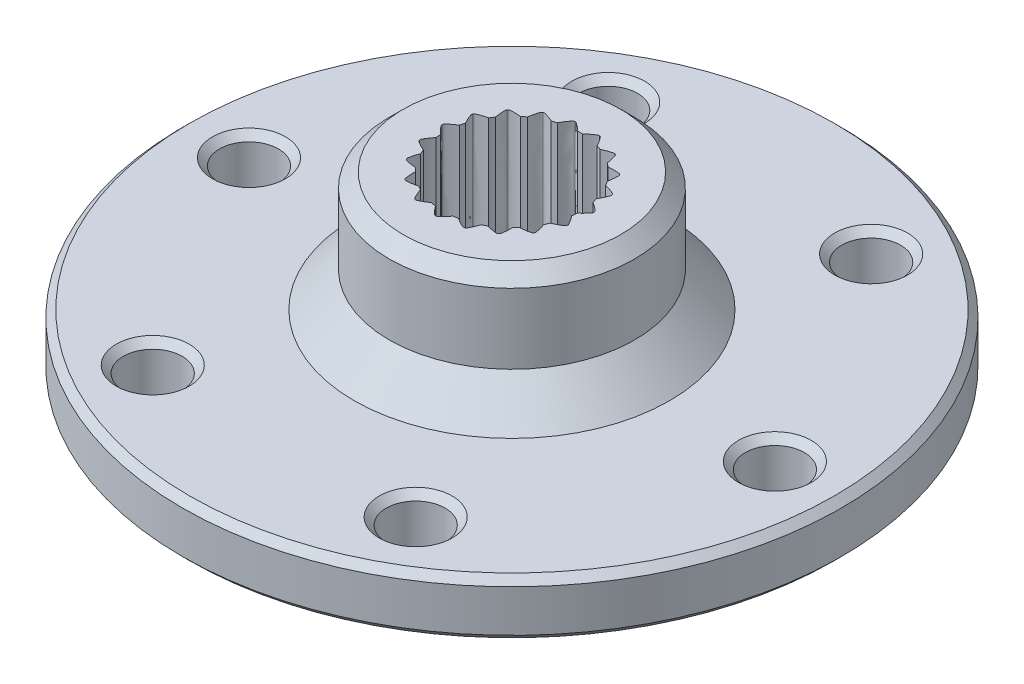
from build123d import *

# Parameters (mm, degrees)
SKETCH1_R            = 47
BOSS_EXTRUDE1_DEPTH  = 8
M8_CLEARANCE_HOLE1_D = 8.4
SKETCH12_R           = 17.5
BOSS_EXTRUDE5_DEPTH  = 17
SKETCH13_R           = 28
BOSS_EXTRUDE6_DEPTH  = 5.08
CHAMFER11_SIZE       = 5
CHAMFER12_SIZE       = 2
SKETCH14_R           = 22.5
CUT_EXTRUDE3_DEPTH   = 5.08
CHAMFER13_SIZE       = 5
CUT_EXTRUDE4_DEPTH   = 73.957565749
CHAMFER14_SIZE       = 1


with BuildPart() as part:
    # Sketch1 → Boss-Extrude1 (new body)
    with BuildSketch(Plane(origin=(0, 0, 0), x_dir=(1, 0, 0), z_dir=(0, 1, 0))):
        with Locations(Location((0, 0, 0), (0, 0, 270))):
            Circle(SKETCH1_R)
    extrude(amount=BOSS_EXTRUDE1_DEPTH)

    # M8 Clearance Hole1 (through all)
    with Locations(Plane(origin=(0, 8, 0), x_dir=(1, 0, 0), z_dir=(0, 1, 0))):
        with Locations((-18.75, 32.475952642), (-37.5, 0), (-18.75, -32.475952642), (18.75, -32.475952642), (37.5, 0), (18.75, 32.475952642)):
            Hole(M8_CLEARANCE_HOLE1_D / 2)

    # Sketch12 → Boss-Extrude5 (add)
    with BuildSketch(Plane(origin=(0, 8, 0), x_dir=(1, 0, 0), z_dir=(0, 1, 0))):
        with Locations(Location((0, 0, 0), (0, 0, 270))):
            Circle(SKETCH12_R)
    extrude(amount=BOSS_EXTRUDE5_DEPTH)

    # Sketch13 → Boss-Extrude6 (add)
    with BuildSketch(Plane.XZ):
        with Locations(Location((0, 0, 0), (0, 0, 90))):
            Circle(SKETCH13_R)
    extrude(amount=BOSS_EXTRUDE6_DEPTH)

    # Chamfer11
    chamfer11_edges = [part.edges().sort_by_distance(p)[0] for p in [
        (0, 8, -17.5),
    ]]
    chamfer(chamfer11_edges, length=CHAMFER11_SIZE)

    # Chamfer12
    chamfer12_edges = [part.edges().sort_by_distance(p)[0] for p in [
        (0, 25, -17.5),
    ]]
    chamfer(chamfer12_edges, length=CHAMFER12_SIZE)

    # Sketch14 → Cut-Extrude3 (cut)
    with BuildSketch(Plane.XZ.offset(5.08)):
        with Locations(Location((0, 0, 0), (0, 0, 270))):
            Circle(SKETCH14_R)
    extrude(amount=-CUT_EXTRUDE3_DEPTH, mode=Mode.SUBTRACT)

    # Chamfer13
    chamfer13_edges = [part.edges().sort_by_distance(p)[0] for p in [
        (0, 0, 22.5),
    ]]
    chamfer(chamfer13_edges, length=CHAMFER13_SIZE)

    # Sketch19 → Cut-Extrude4 (cut, through all)
    with BuildSketch(Plane(origin=(0, 25, 0), x_dir=(1, 0, 0), z_dir=(0, 1, 0))):
        with BuildLine():
            Line((3.525574498, -10.269647669), (3.55492472, -10.259524796))
            add(Edge.make_bspline(
                [(3.55492472, -10.259524796), (3.63112206, -10.233122422), (3.690206879, -10.185276762), (3.751505162, -10.086364139), (3.76893335, -10.050390822), (3.8052542, -9.981218164), (3.894201893, -9.808744646), (4.037820288, -9.502743022), (4.196057711, -9.106848295), (4.280782825, -8.852599963), (4.318331485, -8.728264707)],
                knots=[0, 0, 0, 0, 0.125, 0.125, 0.1875, 0.1875, 0.25, 0.5, 0.75, 1, 1, 1, 1], degree=3))
            ThreePointArc((4.318331485, -8.728264707), (4.634823308, -8.564403337), (4.945107174, -8.389070666))
            add(Edge.make_bspline(
                [(4.945107174, -8.389070666), (5.069733653, -8.425641126), (5.328922638, -8.493772712), (5.74689939, -8.577835597), (6.081625656, -8.624970097), (6.274664484, -8.644840148), (6.352439136, -8.652267408), (6.392087106, -8.657352653), (6.508420421, -8.660135862), (6.580791537, -8.636841128), (6.644570714, -8.587491998)],
                knots=[0, 0, 0, 0, 0.25, 0.5, 0.75, 0.8125, 0.8125, 0.875, 0.875, 1, 1, 1, 1], degree=3))
            Line((6.644570714, -8.587491998), (6.669098294, -8.568457664))
            Line((6.669098294, -8.568457664), (6.693571348, -8.549353274))
            add(Edge.make_bspline(
                [(6.693571348, -8.549353274), (6.75706727, -8.499640217), (6.79741525, -8.435202158), (6.823275347, -8.321745374), (6.828078711, -8.282062267), (6.839971271, -8.204844214), (6.868097473, -8.012834517), (6.904575662, -7.676780089), (6.925692538, -7.250956423), (6.923272713, -6.982973768), (6.918415291, -6.853183309)],
                knots=[0, 0, 0, 0, 0.125, 0.125, 0.1875, 0.1875, 0.25, 0.5, 0.75, 1, 1, 1, 1], degree=3))
            ThreePointArc((6.918415291, -6.853183309), (7.164553015, -6.595435673), (7.40109442, -6.328854004))
            add(Edge.make_bspline(
                [(7.40109442, -6.328854004), (7.530842701, -6.322976823), (7.798110402, -6.303258326), (8.220735194, -6.247049623), (8.552629616, -6.182944804), (8.741660862, -6.139058637), (8.817633096, -6.120830079), (8.856784006, -6.112766116), (8.967717768, -6.077625158), (9.028603829, -6.032093734), (9.072903639, -5.964709411)],
                knots=[0, 0, 0, 0, 0.25, 0.5, 0.75, 0.8125, 0.8125, 0.875, 0.875, 1, 1, 1, 1], degree=3))
            Line((9.072903639, -5.964709411), (9.089921809, -5.938742317))
            Line((9.089921809, -5.938742317), (9.10686566, -5.912726668))
            add(Edge.make_bspline(
                [(9.10686566, -5.912726668), (9.150779394, -5.84509011), (9.168018206, -5.771042515), (9.155637774, -5.655336372), (9.147295794, -5.616243756), (9.133471322, -5.539348082), (9.097728123, -5.348609437), (9.023113128, -5.018918916), (8.904821115, -4.609310913), (8.815518577, -4.356634013), (8.768781451, -4.235453161)],
                knots=[0, 0, 0, 0, 0.125, 0.125, 0.1875, 0.1875, 0.25, 0.5, 0.75, 1, 1, 1, 1], degree=3))
            ThreePointArc((8.768781451, -4.235453161), (8.917892232, -3.911750215), (9.055058245, -3.582807807))
            add(Edge.make_bspline(
                [(9.055058245, -3.582807807), (9.17586809, -3.53511987), (9.422251903, -3.429688096), (9.803726783, -3.239298889), (10.096823448, -3.070901504), (10.261362645, -2.968014865), (10.327299691, -2.926105836), (10.361710932, -2.905766521), (10.455223747, -2.836509463), (10.498026804, -2.773675386), (10.518046673, -2.695558007)],
                knots=[0, 0, 0, 0, 0.25, 0.5, 0.75, 0.8125, 0.8125, 0.875, 0.875, 1, 1, 1, 1], degree=3))
            Line((10.518046673, -2.695558007), (10.52571125, -2.665472091))
            Line((10.52571125, -2.665472091), (10.533289769, -2.635364382))
            add(Edge.make_bspline(
                [(10.533289769, -2.635364382), (10.552862582, -2.557133793), (10.545124133, -2.481500868), (10.495844783, -2.376083923), (10.475261444, -2.341818089), (10.437218035, -2.273577633), (10.341478764, -2.104779533), (10.163856278, -1.817180003), (9.918974151, -1.468175044), (9.752466216, -1.258185363), (9.668914078, -1.158745944)],
                knots=[0, 0, 0, 0, 0.125, 0.125, 0.1875, 0.1875, 0.25, 0.5, 0.75, 1, 1, 1, 1], degree=3))
            ThreePointArc((9.668914078, -1.158745944), (9.704839451, -0.804165924), (9.727766006, -0.448508792))
            add(Edge.make_bspline(
                [(9.727766006, -0.448508792), (9.826545792, -0.364177827), (10.02534621, -0.184457943), (10.324332454, 0.119480142), (10.546869792, 0.373921625), (10.669086564, 0.524659372), (10.71784312, 0.585707377), (10.743785701, 0.616117964), (10.809744003, 0.711986044), (10.82982568, 0.785313728), (10.823396147, 0.865698933)],
                knots=[0, 0, 0, 0, 0.25, 0.5, 0.75, 0.8125, 0.8125, 0.875, 0.875, 1, 1, 1, 1], degree=3))
            Line((10.823396147, 0.865698933), (10.820876555, 0.896643395))
            Line((10.820876555, 0.896643395), (10.818268492, 0.927580526))
            add(Edge.make_bspline(
                [(10.818268492, 0.927580526), (10.811379365, 1.007927648), (10.779502235, 1.076949902), (10.698664151, 1.160654088), (10.668069975, 1.186379905), (10.609930224, 1.23857023), (10.464569717, 1.367135894), (10.203187893, 1.581478561), (9.85825243, 1.832060371), (9.632582816, 1.976607194), (9.521269836, 2.043529377)],
                knots=[0, 0, 0, 0, 0.125, 0.125, 0.1875, 0.1875, 0.25, 0.5, 0.75, 1, 1, 1, 1], degree=3))
            ThreePointArc((9.521269836, 2.043529377), (9.44011673, 2.390562222), (9.346319379, 2.734393111))
            add(Edge.make_bspline(
                [(9.346319379, 2.734393111), (9.412364784, 2.846228535), (9.542038696, 3.08076109), (9.726136505, 3.465311646), (9.853999142, 3.778224543), (9.920649406, 3.960478624), (9.946941942, 4.034050108), (9.961604581, 4.071236507), (9.992860765, 4.183326817), (9.988044902, 4.259201914), (9.955862705, 4.333143961)],
                knots=[0, 0, 0, 0, 0.25, 0.5, 0.75, 0.8125, 0.8125, 0.875, 0.875, 1, 1, 1, 1], degree=3))
            Line((9.955862705, 4.333143961), (9.943431981, 4.361593656))
            Line((9.943431981, 4.361593656), (9.93091996, 4.390007692))
            add(Edge.make_bspline(
                [(9.93091996, 4.390007692), (9.898315437, 4.463764489), (9.845754009, 4.51869644), (9.742117251, 4.571617219), (9.704827593, 4.586015228), (9.632891843, 4.616499791), (9.453662166, 4.690900932), (9.13684578, 4.808759383), (8.729236091, 4.933763618), (8.468859602, 4.997203692), (8.34184827, 5.02435658)],
                knots=[0, 0, 0, 0, 0.125, 0.125, 0.1875, 0.1875, 0.25, 0.5, 0.75, 1, 1, 1, 1], degree=3))
            ThreePointArc((8.34184827, 5.02435658), (8.152410882, 5.326235859), (7.952054023, 5.620981091))
            add(Edge.make_bspline(
                [(7.952054023, 5.620981091), (7.978208003, 5.748201872), (8.024703229, 6.012131856), (8.07396275, 6.435622864), (8.093294785, 6.773098207), (8.09715595, 6.967118564), (8.098135262, 7.045240915), (8.099929035, 7.085173403), (8.093096009, 7.201339217), (8.063904479, 7.271539484), (8.009457059, 7.331025605)],
                knots=[0, 0, 0, 0, 0.25, 0.5, 0.75, 0.8125, 0.8125, 0.875, 0.875, 1, 1, 1, 1], degree=3))
            Line((8.009457059, 7.331025605), (7.988462265, 7.353897568))
            Line((7.988462265, 7.353897568), (7.967402157, 7.376709406))
            add(Edge.make_bspline(
                [(7.967402157, 7.376709406), (7.912615444, 7.435883185), (7.845065564, 7.470772104), (7.729860782, 7.487174688), (7.689916555, 7.488684641), (7.611980161, 7.494159967), (7.418303631, 7.506334068), (7.080384654, 7.514936511), (6.654271574, 7.500817022), (6.387404043, 7.47627563), (6.258458007, 7.460716788)],
                knots=[0, 0, 0, 0, 0.125, 0.125, 0.1875, 0.1875, 0.25, 0.5, 0.75, 1, 1, 1, 1], degree=3))
            ThreePointArc((6.258458007, 7.460716788), (5.981264817, 7.684729195), (5.696060225, 7.898448551))
            add(Edge.make_bspline(
                [(5.696060225, 7.898448551), (5.67948859, 8.027268343), (5.637766651, 8.291994848), (5.54684985, 8.708534485), (5.455556357, 9.034001584), (5.396210007, 9.218763102), (5.371769971, 9.29297055), (5.360500494, 9.331321824), (5.316318723, 9.438974773), (5.26591488, 9.495892922), (5.19510246, 9.534476872)],
                knots=[0, 0, 0, 0, 0.25, 0.5, 0.75, 0.8125, 0.8125, 0.875, 0.875, 1, 1, 1, 1], degree=3))
            Line((5.19510246, 9.534476872), (5.167818708, 9.549292571))
            Line((5.167818708, 9.549292571), (5.140492703, 9.564030195))
            add(Edge.make_bspline(
                [(5.140492703, 9.564030195), (5.069460791, 9.602208559), (4.994242536, 9.613273689), (4.879953957, 9.591380605), (4.841683737, 9.579838875), (4.766192316, 9.559711626), (4.579056791, 9.508339435), (4.256653987, 9.406753661), (3.85821348, 9.255040514), (3.613774145, 9.145177097), (3.496866709, 9.088592566)],
                knots=[0, 0, 0, 0, 0.125, 0.125, 0.1875, 0.1875, 0.25, 0.5, 0.75, 1, 1, 1, 1], degree=3))
            ThreePointArc((3.496866709, 9.088592566), (3.161955901, 9.210462881), (2.822809919, 9.319996554))
            add(Edge.make_bspline(
                [(2.822809919, 9.319996554), (2.765308463, 9.436455733), (2.639890577, 9.673291534), (2.4186497, 10.037741268), (2.226623746, 10.315930713), (2.110500978, 10.471411614), (2.063290052, 10.533662631), (2.040178549, 10.566276734), (1.963435811, 10.653750952), (1.897281696, 10.691219017), (1.8177779, 10.704719627)],
                knots=[0, 0, 0, 0, 0.25, 0.5, 0.75, 0.8125, 0.8125, 0.875, 0.875, 1, 1, 1, 1], degree=3))
            Line((1.8177779, 10.704719627), (1.787161807, 10.709873551))
            Line((1.787161807, 10.709873551), (1.756531102, 10.71493991))
            add(Edge.make_bspline(
                [(1.756531102, 10.71493991), (1.6769514, 10.727985641), (1.602215836, 10.714027905), (1.5012284, 10.656211607), (1.468779359, 10.63286892), (1.403913579, 10.589320197), (1.243598096, 10.479968687), (0.971648813, 10.279203091), (0.644058089, 10.00633676), (0.448535745, 9.823056723), (0.356335643, 9.731578316)],
                knots=[0, 0, 0, 0, 0.125, 0.125, 0.1875, 0.1875, 0.25, 0.5, 0.75, 1, 1, 1, 1], degree=3))
            ThreePointArc((0.356335643, 9.731578316), (0, 9.7381), (-0.356335643, 9.731578316))
            add(Edge.make_bspline(
                [(-0.356335643, 9.731578316), (-0.448535745, 9.823056723), (-0.644058603, 10.006336986), (-0.971648673, 10.279203033), (-1.243598097, 10.479968681), (-1.403913579, 10.589320197), (-1.468779359, 10.63286892), (-1.5012284, 10.656211607), (-1.602215836, 10.714027905), (-1.6769514, 10.727985641), (-1.756531102, 10.71493991)],
                knots=[0, 0, 0, 0, 0.25, 0.5, 0.75, 0.8125, 0.8125, 0.875, 0.875, 1, 1, 1, 1], degree=3))
            Line((-1.756531102, 10.71493991), (-1.787161807, 10.709873551))
            Line((-1.787161807, 10.709873551), (-1.8177779, 10.704719627))
            add(Edge.make_bspline(
                [(-1.8177779, 10.704719627), (-1.897281696, 10.691219017), (-1.963435811, 10.653750952), (-2.040178549, 10.566276734), (-2.063290052, 10.533662631), (-2.110500978, 10.471411614), (-2.226623749, 10.315930719), (-2.418649588, 10.037741369), (-2.639890989, 9.673291153), (-2.765308463, 9.436455733), (-2.822809919, 9.319996554)],
                knots=[0, 0, 0, 0, 0.125, 0.125, 0.1875, 0.1875, 0.25, 0.5, 0.75, 1, 1, 1, 1], degree=3))
            ThreePointArc((-2.822809919, 9.319996554), (-3.161955901, 9.210462881), (-3.496866709, 9.088592566))
            add(Edge.make_bspline(
                [(-3.496866709, 9.088592566), (-3.613774145, 9.145177097), (-3.858214039, 9.255040561), (-4.256653837, 9.406753651), (-4.57905679, 9.508339429), (-4.766192316, 9.559711626), (-4.841683737, 9.579838875), (-4.879953957, 9.591380605), (-4.994242536, 9.613273689), (-5.069460791, 9.602208559), (-5.140492703, 9.564030195)],
                knots=[0, 0, 0, 0, 0.25, 0.5, 0.75, 0.8125, 0.8125, 0.875, 0.875, 1, 1, 1, 1], degree=3))
            Line((-5.140492703, 9.564030195), (-5.167818708, 9.549292571))
            Line((-5.167818708, 9.549292571), (-5.19510246, 9.534476872))
            add(Edge.make_bspline(
                [(-5.19510246, 9.534476872), (-5.26591488, 9.495892922), (-5.316318723, 9.438974773), (-5.360500494, 9.331321824), (-5.371769971, 9.29297055), (-5.396210007, 9.218763102), (-5.455556361, 9.034001588), (-5.546849776, 8.708534617), (-5.637766917, 8.291994354), (-5.67948859, 8.027268343), (-5.696060225, 7.898448551)],
                knots=[0, 0, 0, 0, 0.125, 0.125, 0.1875, 0.1875, 0.25, 0.5, 0.75, 1, 1, 1, 1], degree=3))
            ThreePointArc((-5.696060225, 7.898448551), (-5.981264817, 7.684729195), (-6.258458007, 7.460716788))
            add(Edge.make_bspline(
                [(-6.258458007, 7.460716788), (-6.387404043, 7.47627563), (-6.654272118, 7.500816885), (-7.080384508, 7.51493655), (-7.418303628, 7.506334063), (-7.611980161, 7.494159967), (-7.689916555, 7.488684641), (-7.729860782, 7.487174688), (-7.845065564, 7.470772104), (-7.912615444, 7.435883185), (-7.967402157, 7.376709406)],
                knots=[0, 0, 0, 0, 0.25, 0.5, 0.75, 0.8125, 0.8125, 0.875, 0.875, 1, 1, 1, 1], degree=3))
            Line((-7.967402157, 7.376709406), (-7.988462265, 7.353897568))
            Line((-7.988462265, 7.353897568), (-8.009457059, 7.331025605))
            add(Edge.make_bspline(
                [(-8.009457059, 7.331025605), (-8.063904479, 7.271539484), (-8.093096009, 7.201339217), (-8.099929035, 7.085173403), (-8.098135262, 7.045240915), (-8.09715595, 6.967118564), (-8.09329479, 6.773098209), (-8.073962723, 6.435623012), (-8.02470332, 6.012131303), (-7.978208003, 5.748201872), (-7.952054023, 5.620981091)],
                knots=[0, 0, 0, 0, 0.125, 0.125, 0.1875, 0.1875, 0.25, 0.5, 0.75, 1, 1, 1, 1], degree=3))
            ThreePointArc((-7.952054023, 5.620981091), (-8.152410882, 5.326235859), (-8.34184827, 5.02435658))
            add(Edge.make_bspline(
                [(-8.34184827, 5.02435658), (-8.468859602, 4.997203692), (-8.729236561, 4.933763312), (-9.136845654, 4.808759468), (-9.453662162, 4.690900928), (-9.632891843, 4.616499791), (-9.704827593, 4.586015228), (-9.742117251, 4.571617219), (-9.845754009, 4.51869644), (-9.898315437, 4.463764489), (-9.93091996, 4.390007692)],
                knots=[0, 0, 0, 0, 0.25, 0.5, 0.75, 0.8125, 0.8125, 0.875, 0.875, 1, 1, 1, 1], degree=3))
            Line((-9.93091996, 4.390007692), (-9.943431981, 4.361593656))
            Line((-9.943431981, 4.361593656), (-9.955862705, 4.333143961))
            add(Edge.make_bspline(
                [(-9.955862705, 4.333143961), (-9.988044902, 4.259201914), (-9.992860765, 4.183326817), (-9.961604581, 4.071236507), (-9.946941942, 4.034050108), (-9.920649406, 3.960478624), (-9.853999148, 3.778224543), (-9.726136528, 3.465311796), (-9.542038602, 3.080760537), (-9.412364784, 2.846228535), (-9.346319379, 2.734393111)],
                knots=[0, 0, 0, 0, 0.125, 0.125, 0.1875, 0.1875, 0.25, 0.5, 0.75, 1, 1, 1, 1], degree=3))
            ThreePointArc((-9.346319379, 2.734393111), (-9.44011673, 2.390562222), (-9.521269836, 2.043529377))
            add(Edge.make_bspline(
                [(-9.521269836, 2.043529377), (-9.632582816, 1.976607194), (-9.858252775, 1.832059929), (-10.203187801, 1.581478681), (-10.464569711, 1.367135891), (-10.609930224, 1.23857023), (-10.668069975, 1.186379905), (-10.698664151, 1.160654088), (-10.779502235, 1.076949902), (-10.811379365, 1.007927648), (-10.818268492, 0.927580526)],
                knots=[0, 0, 0, 0, 0.25, 0.5, 0.75, 0.8125, 0.8125, 0.875, 0.875, 1, 1, 1, 1], degree=3))
            Line((-10.818268492, 0.927580526), (-10.820876555, 0.896643395))
            Line((-10.820876555, 0.896643395), (-10.823396147, 0.865698933))
            add(Edge.make_bspline(
                [(-10.823396147, 0.865698933), (-10.82982568, 0.785313728), (-10.809744003, 0.711986044), (-10.743785701, 0.616117964), (-10.71784312, 0.585707377), (-10.669086564, 0.524659372), (-10.546869798, 0.373921623), (-10.324332524, 0.119480276), (-10.025345942, -0.184458436), (-9.826545792, -0.364177827), (-9.727766006, -0.448508792)],
                knots=[0, 0, 0, 0, 0.125, 0.125, 0.1875, 0.1875, 0.25, 0.5, 0.75, 1, 1, 1, 1], degree=3))
            ThreePointArc((-9.727766006, -0.448508792), (-9.704839451, -0.804165924), (-9.668914078, -1.158745944))
            add(Edge.make_bspline(
                [(-9.668914078, -1.158745944), (-9.752466216, -1.258185363), (-9.918974334, -1.468175575), (-10.163856231, -1.817179859), (-10.341478758, -2.104779533), (-10.437218035, -2.273577633), (-10.475261444, -2.341818089), (-10.495844783, -2.376083923), (-10.545124133, -2.481500868), (-10.552862582, -2.557133793), (-10.533289769, -2.635364382)],
                knots=[0, 0, 0, 0, 0.25, 0.5, 0.75, 0.8125, 0.8125, 0.875, 0.875, 1, 1, 1, 1], degree=3))
            Line((-10.533289769, -2.635364382), (-10.52571125, -2.665472091))
            Line((-10.52571125, -2.665472091), (-10.518046673, -2.695558007))
            add(Edge.make_bspline(
                [(-10.518046673, -2.695558007), (-10.498026804, -2.773675386), (-10.455223747, -2.836509463), (-10.361710932, -2.905766521), (-10.327299691, -2.926105836), (-10.261362645, -2.968014865), (-10.096823453, -3.070901507), (-9.803726893, -3.239298785), (-9.42225149, -3.429688475), (-9.17586809, -3.53511987), (-9.055058245, -3.582807807)],
                knots=[0, 0, 0, 0, 0.125, 0.125, 0.1875, 0.1875, 0.25, 0.5, 0.75, 1, 1, 1, 1], degree=3))
            ThreePointArc((-9.055058245, -3.582807807), (-8.917892232, -3.911750215), (-8.768781451, -4.235453161))
            add(Edge.make_bspline(
                [(-8.768781451, -4.235453161), (-8.815518577, -4.356634013), (-8.904821116, -4.609311474), (-9.02311313, -5.018918765), (-9.097728117, -5.348609436), (-9.133471322, -5.539348082), (-9.147295794, -5.616243756), (-9.155637774, -5.655336372), (-9.168018206, -5.771042515), (-9.150779394, -5.84509011), (-9.10686566, -5.912726668)],
                knots=[0, 0, 0, 0, 0.25, 0.5, 0.75, 0.8125, 0.8125, 0.875, 0.875, 1, 1, 1, 1], degree=3))
            Line((-9.10686566, -5.912726668), (-9.089921809, -5.938742317))
            Line((-9.089921809, -5.938742317), (-9.072903639, -5.964709411))
            add(Edge.make_bspline(
                [(-9.072903639, -5.964709411), (-9.028603829, -6.032093734), (-8.967717768, -6.077625158), (-8.856784006, -6.112766116), (-8.817633096, -6.120830079), (-8.741660862, -6.139058637), (-8.552629619, -6.182944809), (-8.220735332, -6.247049561), (-7.798109887, -6.303258551), (-7.530842701, -6.322976823), (-7.40109442, -6.328854004)],
                knots=[0, 0, 0, 0, 0.125, 0.125, 0.1875, 0.1875, 0.25, 0.5, 0.75, 1, 1, 1, 1], degree=3))
            ThreePointArc((-7.40109442, -6.328854004), (-7.164553015, -6.595435673), (-6.918415291, -6.853183309))
            add(Edge.make_bspline(
                [(-6.918415291, -6.853183309), (-6.923272713, -6.982973768), (-6.925692356, -7.250956954), (-6.904575713, -7.676779947), (-6.868097468, -8.012834514), (-6.839971271, -8.204844214), (-6.828078711, -8.282062267), (-6.823275347, -8.321745374), (-6.79741525, -8.435202158), (-6.75706727, -8.499640217), (-6.693571348, -8.549353274)],
                knots=[0, 0, 0, 0, 0.25, 0.5, 0.75, 0.8125, 0.8125, 0.875, 0.875, 1, 1, 1, 1], degree=3))
            Line((-6.693571348, -8.549353274), (-6.669098294, -8.568457664))
            Line((-6.669098294, -8.568457664), (-6.644570714, -8.587491998))
            add(Edge.make_bspline(
                [(-6.644570714, -8.587491998), (-6.580791537, -8.636841128), (-6.508420421, -8.660135862), (-6.392087106, -8.657352653), (-6.352439136, -8.652267408), (-6.274664484, -8.644840148), (-6.081625658, -8.624970102), (-5.74689954, -8.577835583), (-5.328922078, -8.493772758), (-5.069733653, -8.425641126), (-4.945107174, -8.389070666)],
                knots=[0, 0, 0, 0, 0.125, 0.125, 0.1875, 0.1875, 0.25, 0.5, 0.75, 1, 1, 1, 1], degree=3))
            ThreePointArc((-4.945107174, -8.389070666), (-4.634823308, -8.564403337), (-4.318331485, -8.728264707))
            add(Edge.make_bspline(
                [(-4.318331485, -8.728264707), (-4.280782825, -8.852599963), (-4.196057367, -9.106848738), (-4.037820382, -9.502742904), (-3.89420189, -9.808744641), (-3.8052542, -9.981218164), (-3.76893335, -10.050390822), (-3.751505162, -10.086364139), (-3.690206879, -10.185276762), (-3.63112206, -10.233122422), (-3.55492472, -10.259524796)],
                knots=[0, 0, 0, 0, 0.25, 0.5, 0.75, 0.8125, 0.8125, 0.875, 0.875, 1, 1, 1, 1], degree=3))
            Line((-3.55492472, -10.259524796), (-3.525574498, -10.269647669))
            Line((-3.525574498, -10.269647669), (-3.496195452, -10.279686579))
            add(Edge.make_bspline(
                [(-3.496195452, -10.279686579), (-3.41984837, -10.305652771), (-3.343834733, -10.30418647), (-3.234708384, -10.263780697), (-3.198859827, -10.24609731), (-3.127710847, -10.213819091), (-2.951583191, -10.132346055), (-2.65029801, -9.979080021), (-2.282262875, -9.763854892), (-2.059240299, -9.615256476), (-1.953240835, -9.540201353)],
                knots=[0, 0, 0, 0, 0.125, 0.125, 0.1875, 0.1875, 0.25, 0.5, 0.75, 1, 1, 1, 1], degree=3))
            ThreePointArc((-1.953240835, -9.540201353), (-1.60283858, -9.605285009), (-1.250289457, -9.657503191))
            add(Edge.make_bspline(
                [(-1.250289457, -9.657503191), (-1.174403694, -9.76290959), (-1.011714454, -9.975872154), (-0.73350456, -10.298936216), (-0.498309111, -10.541725087), (-0.358178791, -10.675972252), (-0.30136558, -10.729603584), (-0.273201183, -10.757968844), (-0.183107333, -10.831618588), (-0.111688433, -10.857687028), (-0.031046837, -10.857917613)],
                knots=[0, 0, 0, 0, 0.25, 0.5, 0.75, 0.8125, 0.8125, 0.875, 0.875, 1, 1, 1, 1], degree=3))
            Line((-0.031046837, -10.857917613), (0, -10.857962))
            Line((0, -10.857962), (0.031046837, -10.857917613))
            add(Edge.make_bspline(
                [(0.031046837, -10.857917613), (0.111688433, -10.857687028), (0.183107333, -10.831618588), (0.273201183, -10.757968844), (0.30136558, -10.729603584), (0.358178791, -10.675972252), (0.498309113, -10.541725093), (0.733504432, -10.298936297), (1.011714923, -9.975871846), (1.174403694, -9.76290959), (1.250289457, -9.657503191)],
                knots=[0, 0, 0, 0, 0.125, 0.125, 0.1875, 0.1875, 0.25, 0.5, 0.75, 1, 1, 1, 1], degree=3))
            ThreePointArc((1.250289457, -9.657503191), (1.60283858, -9.605285009), (1.953240835, -9.540201353))
            add(Edge.make_bspline(
                [(1.953240835, -9.540201353), (2.059240299, -9.615256476), (2.282263419, -9.76385503), (2.650297864, -9.979079986), (2.951583191, -10.132346049), (3.127710847, -10.213819091), (3.198859827, -10.24609731), (3.234708384, -10.263780697), (3.343834733, -10.30418647), (3.41984837, -10.305652771), (3.496195452, -10.279686579)],
                knots=[0, 0, 0, 0, 0.25, 0.5, 0.75, 0.8125, 0.8125, 0.875, 0.875, 1, 1, 1, 1], degree=3))
            Line((3.496195452, -10.279686579), (3.525574498, -10.269647669))
        make_face()
    extrude(amount=-CUT_EXTRUDE4_DEPTH, mode=Mode.SUBTRACT)

    # Chamfer14
    chamfer14_edges = [part.edges().sort_by_distance(p)[0] for p in [
        (0, 8, -47),
        (-14.55, 8, -32.475952642),
        (22.95, 8, -32.475952642),
        (41.7, 8, 0),
        (22.95, 8, 32.475952642),
        (0, 0, -47),
        (-14.55, 8, 32.475952642),
        (-33.3, 8, 0),
        (0, -5.08, -28),
    ]]
    chamfer(chamfer14_edges, length=CHAMFER14_SIZE)


solid = part.part
